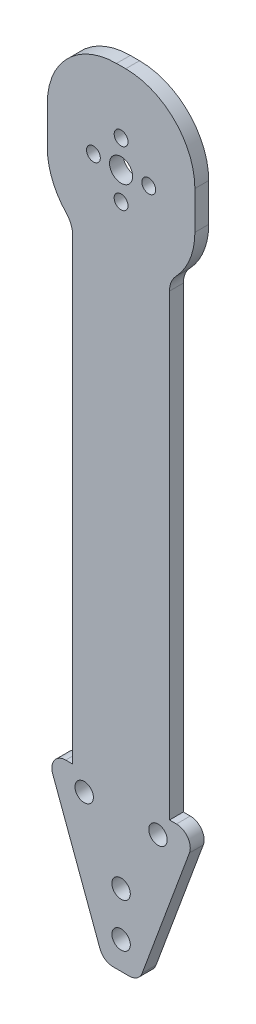
from build123d import *

# Parameters (mm, degrees)
CROQUIS1_R              = 2
CROQUIS1_R_2            = 2.5
CROQUIS1_R_3            = 1.5
SALIENTE_EXTRUIR1_DEPTH = 3


with BuildPart() as part:
    # Croquis1 → Saliente-Extruir1 (new body)
    with BuildSketch(Plane.XY):
        with BuildLine():
            Line((1.762553306, 0), (-1.762553306, 0))
            ThreePointArc((-1.762553306, 0), (-3.476899283, 0.538086543), (-4.576267594, 1.95932142))
            Line((-4.576267594, 1.95932142), (-14.815986324, 29.644759985))
            ThreePointArc((-14.815986324, 29.644759985), (-14.464185493, 32.399784542), (-12.002272036, 33.685438565))
            Line((-12.002272036, 33.685438565), (-10.5, 33.685438565))
            Line((-10.5, 33.685438565), (-10.5, 133))
            ThreePointArc((-10.5, 133), (-10.856456095, 134.854049622), (-11.875, 136.443744328))
            ThreePointArc((-11.875, 136.443744328), (-14.930631716, 141.212828449), (-16, 146.774977314))
            Line((-16, 146.774977314), (-16, 155))
            ThreePointArc((-16, 155), (-11.606601718, 165.606601718), (-1, 170))
            Line((-1, 170), (1, 170))
            ThreePointArc((1, 170), (11.606601718, 165.606601718), (16, 155))
            Line((16, 155), (16, 146.774977314))
            ThreePointArc((16, 146.774977314), (14.930631716, 141.212828449), (11.875, 136.443744328))
            ThreePointArc((11.875, 136.443744328), (10.856456095, 134.854049622), (10.5, 133))
            Line((10.5, 133), (10.5, 33.685438565))
            Line((10.5, 33.685438565), (12.002272036, 33.685438565))
            ThreePointArc((12.002272036, 33.685438565), (14.464185493, 32.399784542), (14.815986324, 29.644759985))
            Line((14.815986324, 29.644759985), (4.576267594, 1.95932142))
            ThreePointArc((4.576267594, 1.95932142), (3.476899283, 0.538086543), (1.762553306, 0))
        make_face()
        with Locations((0, 6)):
            Circle(CROQUIS1_R, mode=Mode.SUBTRACT)
        with Locations((0, 150.5)):
            Circle(CROQUIS1_R_2, mode=Mode.SUBTRACT)
        with Locations((0, 144.5)):
            Circle(CROQUIS1_R_3, mode=Mode.SUBTRACT)
        with Locations((-6, 150.5)):
            Circle(CROQUIS1_R_3, mode=Mode.SUBTRACT)
        with Locations(Location((0, 156.5, 0), (0, 0, 180))):
            Circle(CROQUIS1_R_3, mode=Mode.SUBTRACT)
        with Locations(Location((6, 150.5, 0), (0, 0, 180))):
            Circle(CROQUIS1_R_3, mode=Mode.SUBTRACT)
        with Locations((-8, 29.685438565)):
            Circle(CROQUIS1_R, mode=Mode.SUBTRACT)
        with Locations((8, 29.685438565)):
            Circle(CROQUIS1_R, mode=Mode.SUBTRACT)
        with Locations((0, 15.55)):
            Circle(CROQUIS1_R, mode=Mode.SUBTRACT)
    extrude(amount=SALIENTE_EXTRUIR1_DEPTH)


solid = part.part
